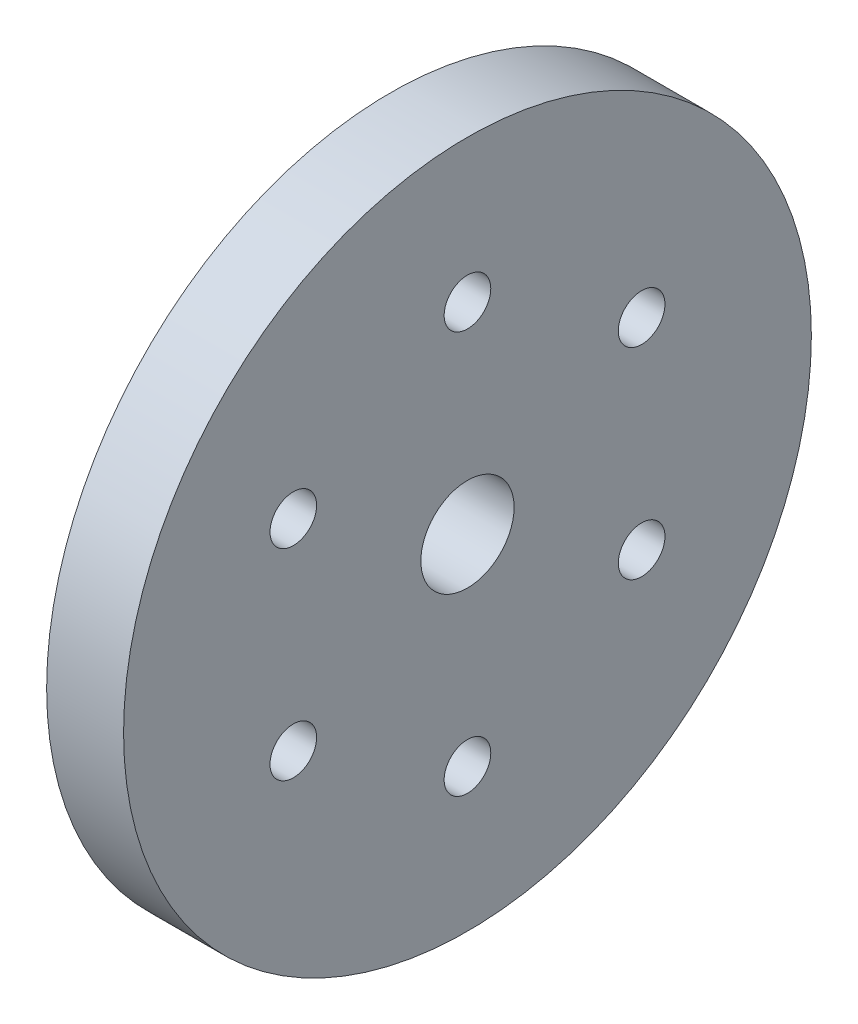
from build123d import *

# Parameters (mm, degrees)
SKETCH_1_R          = 29.5
EXTRUDE_1_DEPTH     = 6.6
SKETCH_2_R          = 2
CUT_EXTRUDE_1_DEPTH = 6.6
SKETCH_3_R          = 4
CUT_EXTRUDE_2_DEPTH = 6.6


with BuildPart() as part:
    # 草图1 → 凸台-拉伸1 (new body)
    with BuildSketch(Plane(origin=(0, 0, 0), x_dir=(0, 0, -1), z_dir=(1, 0, 0))):
        Circle(SKETCH_1_R)
    extrude(amount=EXTRUDE_1_DEPTH)

    # 草图2 → 切除-拉伸1 (cut)
    with BuildSketch(Plane(origin=(6.6, 0, 0), x_dir=(0, 0, -1), z_dir=(1, 0, 0))):
        with Locations((0, 17.25)):
            Circle(SKETCH_2_R)
        with Locations((14.938938215, 8.625)):
            Circle(SKETCH_2_R)
        with Locations((14.938938215, -8.625)):
            Circle(SKETCH_2_R)
        with Locations((0, -17.25)):
            Circle(SKETCH_2_R)
        with Locations((-14.938938215, -8.625)):
            Circle(SKETCH_2_R)
        with Locations((-14.938938215, 8.625)):
            Circle(SKETCH_2_R)
    extrude(amount=-CUT_EXTRUDE_1_DEPTH, mode=Mode.SUBTRACT)

    # 草图3 → 切除-拉伸2 (cut)
    with BuildSketch(Plane(origin=(6.6, 0, 0), x_dir=(0, 0, -1), z_dir=(1, 0, 0))):
        Circle(SKETCH_3_R)
    extrude(amount=-CUT_EXTRUDE_2_DEPTH, mode=Mode.SUBTRACT)


solid = part.part
